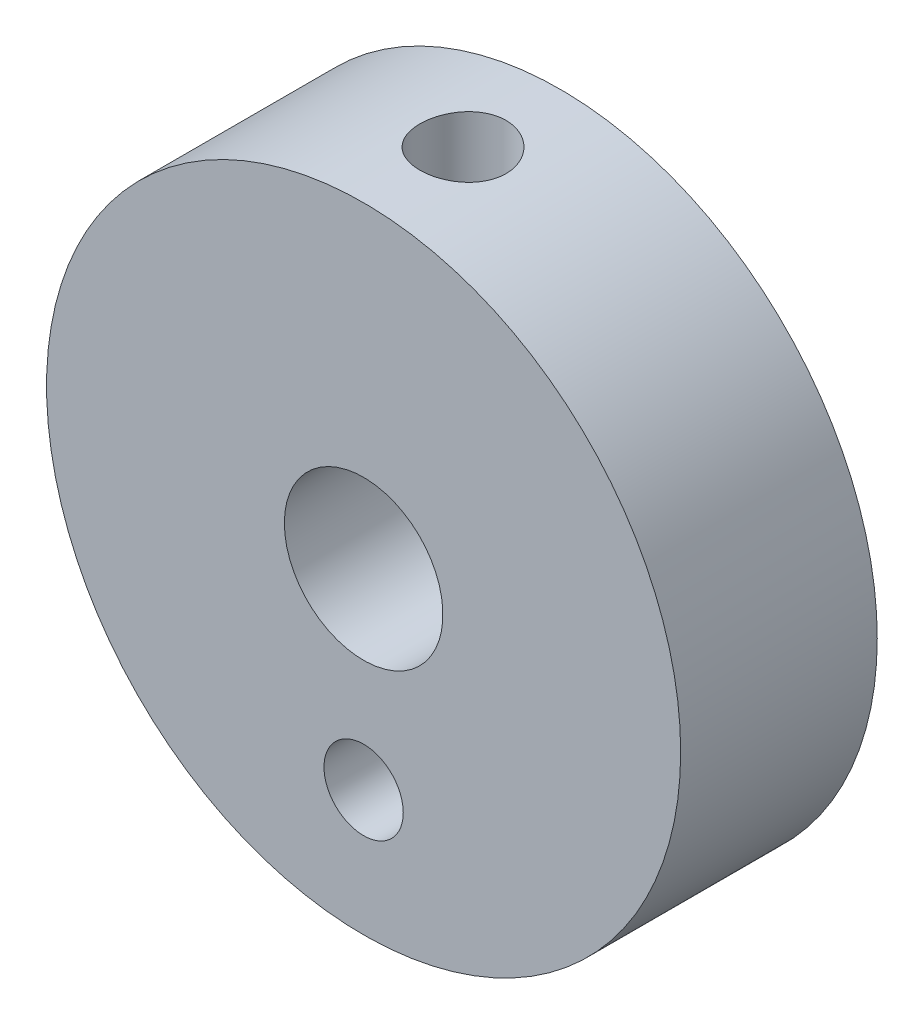
from build123d import *

# Parameters (mm, degrees)
SKETCH1_R                  = 12.7
BOSS_EXTRUDE1_DEPTH        = 7.874
F_1_4_0_2500_DOWEL_HOLE1_D = 6.35
F_1_8_0_1250_DOWEL_HOLE1_D = 3.175


with BuildPart() as part:
    # Sketch1 → Boss-Extrude1 (new body)
    with BuildSketch(Plane.XY):
        Circle(SKETCH1_R)
    extrude(amount=BOSS_EXTRUDE1_DEPTH)

    # 1/4 (0.2500) Dowel Hole1 (through all)
    with Locations(Plane(origin=(0, 0, 0), x_dir=(1, 0, 0), z_dir=(0, 0, -1))):
        with Locations((0, 0)):
            Hole(F_1_4_0_2500_DOWEL_HOLE1_D / 2)

    # 1/8 (0.1250) Dowel Hole1 (through all)
    with Locations(Plane.XY.offset(7.874)):
        with Locations((0, -7.669668031)):
            Hole(F_1_8_0_1250_DOWEL_HOLE1_D / 2)

    # Sketch7 → #8-32 Tapped Hole1 (revolve, cut)
    with BuildSketch(Plane(origin=(0, 0, 3.892930906), x_dir=(0, 0, -1), z_dir=(1, 0, 0))):
        Polygon((0, 0), (0, 13.97), (1.7272, 12.932193539), (1.7272, 0), align=None)
    revolve(axis=Axis((0, -6.35, 3.892930906), (0, 1, 0)), mode=Mode.SUBTRACT)


solid = part.part
